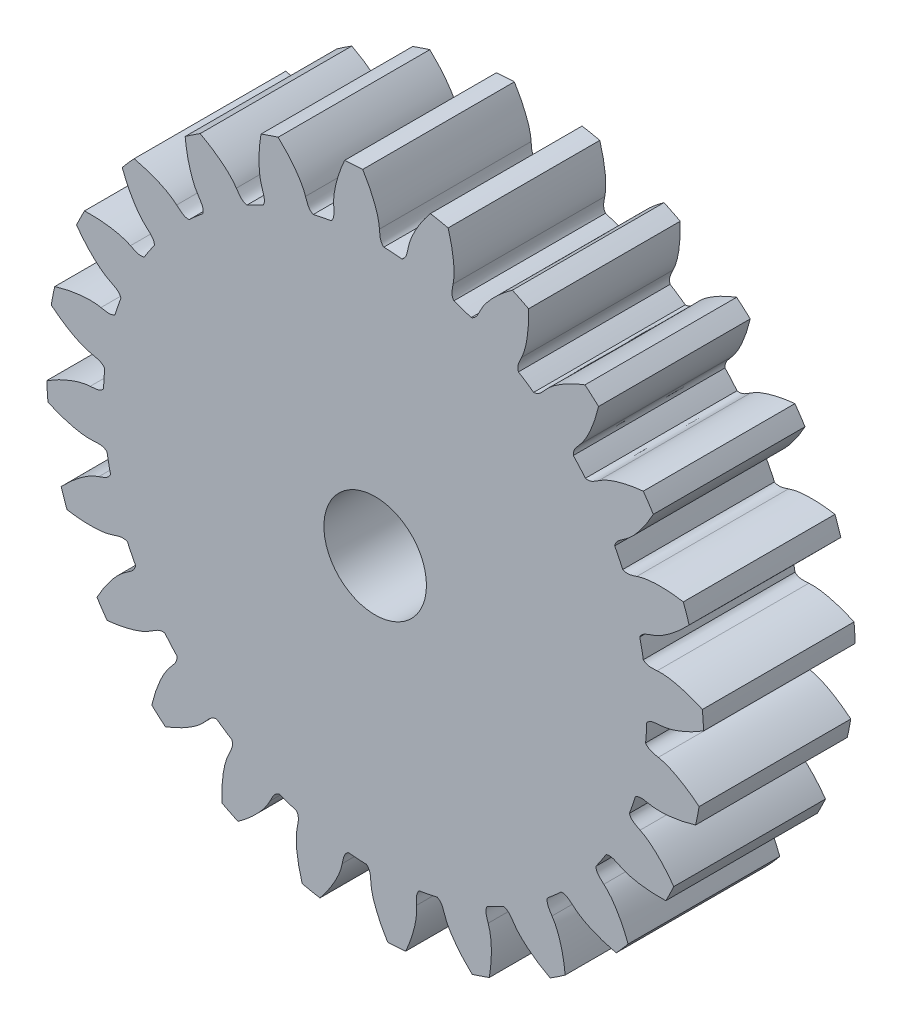
from build123d import *

# Parameters (mm, degrees)
SKETCH5_R               = 22.75
BOSS_EXTRUDE1_DEPTH     = 10.5
CUT_EXTRUDE1_DEPTH      = 34.84338931
CIRPATTERN1_COUNT       = 24
SKETCH7_R               = 5
BOSS_EXTRUDE2_DEPTH     = 0.5
CUT_EXTRUDE2_DEPTH      = 34.821409928
CUT_EXTRUDE2_DEPTH_BACK = 34.821409928
SKETCH6_R               = 3.55
BOSS_EXTRUDE4_START     = -4
SKETCH11_R              = 3.55
SKETCH11_R_2            = 3.15
BOSS_EXTRUDE4_DEPTH     = 0.4


with BuildPart() as part:
    # Sketch5 → Boss-Extrude1 (new body)
    with BuildSketch(Plane.XY):
        Circle(SKETCH5_R)
    extrude(amount=BOSS_EXTRUDE1_DEPTH)

    # Sketch4 → Cut-Extrude1 (cut, through all)
    with BuildSketch(Plane.XY):
        with BuildLine():
            ThreePointArc((0.598907002, 18.802964305), (1.230396369, 18.772220993), (1.860496064, 18.720275389))
            add(Edge.make_bspline(
                [(2.283869081, 19.600937267), (2.215462985, 19.285509645), (2.167929713, 18.908289569), (1.860496064, 18.720275389)],
                knots=[0, 0, 0, 0, 1, 1, 1, 1], degree=3))
            add(Edge.make_bspline(
                [(10.799590621, 27.148967655), (8.772341046, 26.37441695), (6.148696593, 24.917766721), (3.719334953, 22.395161014), (2.754083149, 20.939062818), (2.364255785, 20.0300087), (2.283869081, 19.600937267)],
                knots=[0, 0, 0, 0, 0.555544794, 0.749986395, 0.888874506, 1, 1, 1, 1], degree=3))
            ThreePointArc((10.799590621, 27.148967655), (1.910955433, 29.155545813), (-7.163547256, 28.326333915))
            add(Edge.make_bspline(
                [(-7.163547256, 28.326333915), (-5.254740236, 27.29380043), (-2.843672433, 25.507157726), (-0.764360436, 22.689037936), (0.002574552, 21.119406219), (0.270411516, 20.167246504), (0.294105441, 19.731353266)],
                knots=[0, 0, 0, 0, 0.555544794, 0.749986395, 0.888874506, 1, 1, 1, 1], degree=3))
            add(Edge.make_bspline(
                [(0.294105441, 19.731353266), (0.320754746, 19.409695384), (0.318644265, 19.029498141), (0.598907002, 18.802964305)],
                knots=[0, 0, 0, 0, 1, 1, 1, 1], degree=3))
        make_face()
    cut_extrude1 = extrude(amount=CUT_EXTRUDE1_DEPTH, mode=Mode.SUBTRACT)

    # CirPattern1: Cut-Extrude1 ×24 about axis
    cirpattern1_axis = Axis((0, 0, 10.5), (0, 0, -1))
    for i in range(1, CIRPATTERN1_COUNT):
        add(cut_extrude1.rotate(cirpattern1_axis, i * 360 / CIRPATTERN1_COUNT), mode=Mode.SUBTRACT)

    # Sketch7 → Boss-Extrude2 (add)
    with BuildSketch(Plane(origin=(0, 0, 0), x_dir=(-1, 0, 0), z_dir=(0, 0, -1))):
        Circle(SKETCH7_R)
    extrude(amount=BOSS_EXTRUDE2_DEPTH)

    # Sketch6 → Cut-Extrude2 (cut, two sides: drawn at the far end of the back side and taken through both)
    with BuildSketch(Plane.XY.offset(-CUT_EXTRUDE2_DEPTH_BACK)):
        Circle(SKETCH6_R)
    extrude(amount=CUT_EXTRUDE2_DEPTH + CUT_EXTRUDE2_DEPTH_BACK, mode=Mode.SUBTRACT)

    # Sketch11 → Boss-Extrude4 (add)
    with BuildSketch(Plane(origin=(0, 0, -0.5), x_dir=(-1, 0, 0), z_dir=(0, 0, -1)).offset(BOSS_EXTRUDE4_START)):
        Circle(SKETCH11_R)
        Circle(SKETCH11_R_2, mode=Mode.SUBTRACT)
    extrude(amount=BOSS_EXTRUDE4_DEPTH)


solid = part.part
